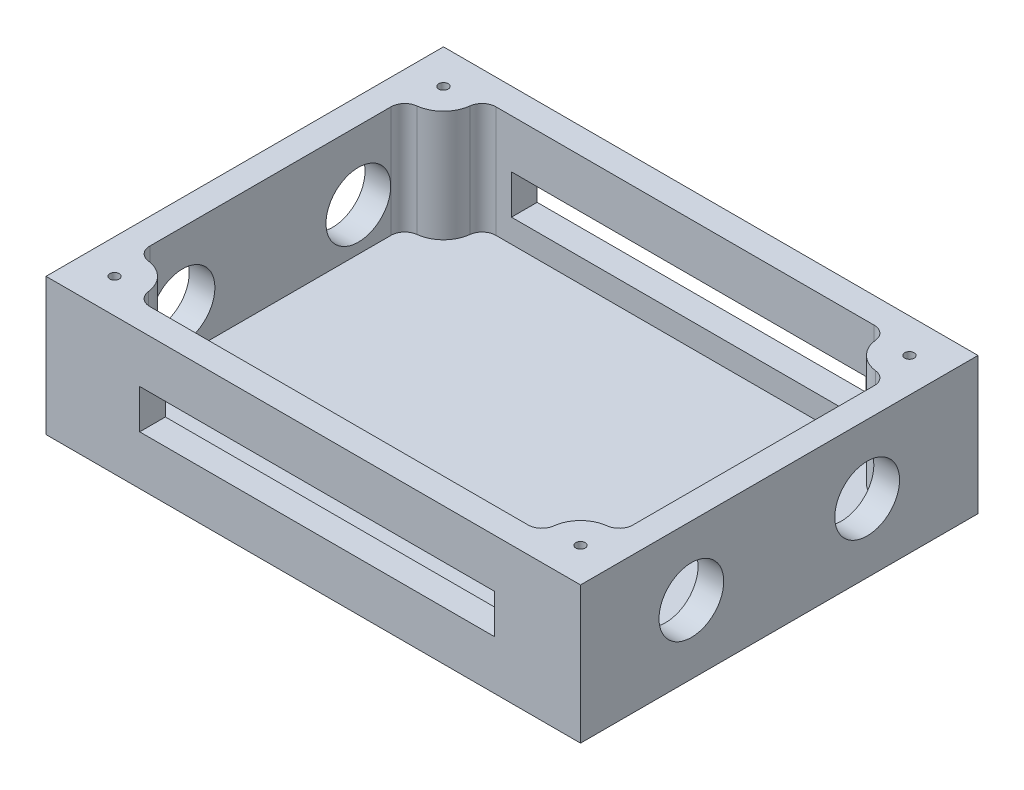
from build123d import *

# Parameters (mm, degrees)
SKETCH1_W                    = 99.06
SKETCH1_H                    = 73.66
BOSS_EXTRUDE1_DEPTH          = 25.4
M2_2X0_45_TAPPED_HOLE2_D     = 1.75
M2_2X0_45_TAPPED_HOLE2_DEPTH = 30.48
M2_2X0_45_TAPPED_HOLE2_TIP   = 0.525753042
SHELL3_T                     = -4.7625
FILLET2_R                    = 2.54
CUT_EXTRUDE1_DEPTH           = 109.694491581
CUT_EXTRUDE1_DEPTH_BACK      = 109.694491581
SKETCH11_R                   = 6
CUT_EXTRUDE2_DEPTH           = 93.326466953
CUT_EXTRUDE2_DEPTH_BACK      = 93.326466953
SKETCH12_W                   = 65.724340076
SKETCH12_H                   = 7.280106329


with BuildPart() as part:
    # Sketch1 → Boss-Extrude1 (new body)
    with BuildSketch(Plane(origin=(0, 0, 0), x_dir=(1, 0, 0), z_dir=(0, 1, 0))):
        Rectangle(SKETCH1_W, SKETCH1_H)
    extrude(amount=BOSS_EXTRUDE1_DEPTH)

    # M2.2x0.45 Tapped Hole2
    with Locations(Plane(origin=(0, 25.4, 0), x_dir=(1, 0, 0), z_dir=(0, 1, 0))):
        with Locations((-43.18, 30.48), (43.18, 30.48), (43.18, -30.48), (-43.18, -30.48)):
            Hole(M2_2X0_45_TAPPED_HOLE2_D / 2, depth=M2_2X0_45_TAPPED_HOLE2_DEPTH)
            with Locations((0, 0, -(M2_2X0_45_TAPPED_HOLE2_DEPTH + M2_2X0_45_TAPPED_HOLE2_TIP / 2))):  # 118° drill point
                Cone(0, M2_2X0_45_TAPPED_HOLE2_D / 2, M2_2X0_45_TAPPED_HOLE2_TIP, mode=Mode.SUBTRACT)

    # Shell3
    shell3_openings = [part.faces().sort_by_distance(p)[0] for p in [
        (0, 25.4, 0),
    ]]
    offset(amount=SHELL3_T, openings=shell3_openings, kind=Kind.INTERSECTION)

    # Fillet2
    fillet2_edges = [part.edges().sort_by_distance(p)[0] for p in [
        (-44.7675, 15.08125, -25.070633124),
        (-37.770633124, 15.08125, 32.0675),
        (44.7675, 15.08125, 25.070633124),
        (37.770633124, 15.08125, -32.0675),
        (-44.7675, 15.08125, 25.070633124),
        (37.770633124, 15.08125, 32.0675),
        (44.7675, 15.08125, -25.070633124),
        (-37.770633124, 15.08125, -32.0675),
    ]]
    fillet(fillet2_edges, radius=FILLET2_R)

    # Sketch11 → Cut-Extrude1 (cut, two sides: drawn at the far end of the back side and taken through both)
    with BuildSketch(Plane(origin=(49.53, 0, 0), x_dir=(0, 0, -1), z_dir=(1, 0, 0)).offset(-CUT_EXTRUDE1_DEPTH_BACK)):
        with Locations((-16.290648395, 12.7)):
            Circle(SKETCH11_R)
        with Locations((16.290648395, 12.7)):
            Circle(SKETCH11_R)
    extrude(amount=CUT_EXTRUDE1_DEPTH + CUT_EXTRUDE1_DEPTH_BACK, mode=Mode.SUBTRACT)

    # Sketch12 → Cut-Extrude2 (cut, two sides: drawn at the far end of the back side and taken through both)
    with BuildSketch(Plane(origin=(0, 0, -36.83), x_dir=(-1, 0, 0), z_dir=(0, 0, -1)).offset(-CUT_EXTRUDE2_DEPTH_BACK)):
        with Locations((-0.694647497, 12.759946836)):
            Rectangle(SKETCH12_W, SKETCH12_H)
    extrude(amount=CUT_EXTRUDE2_DEPTH + CUT_EXTRUDE2_DEPTH_BACK, mode=Mode.SUBTRACT)


solid = part.part
